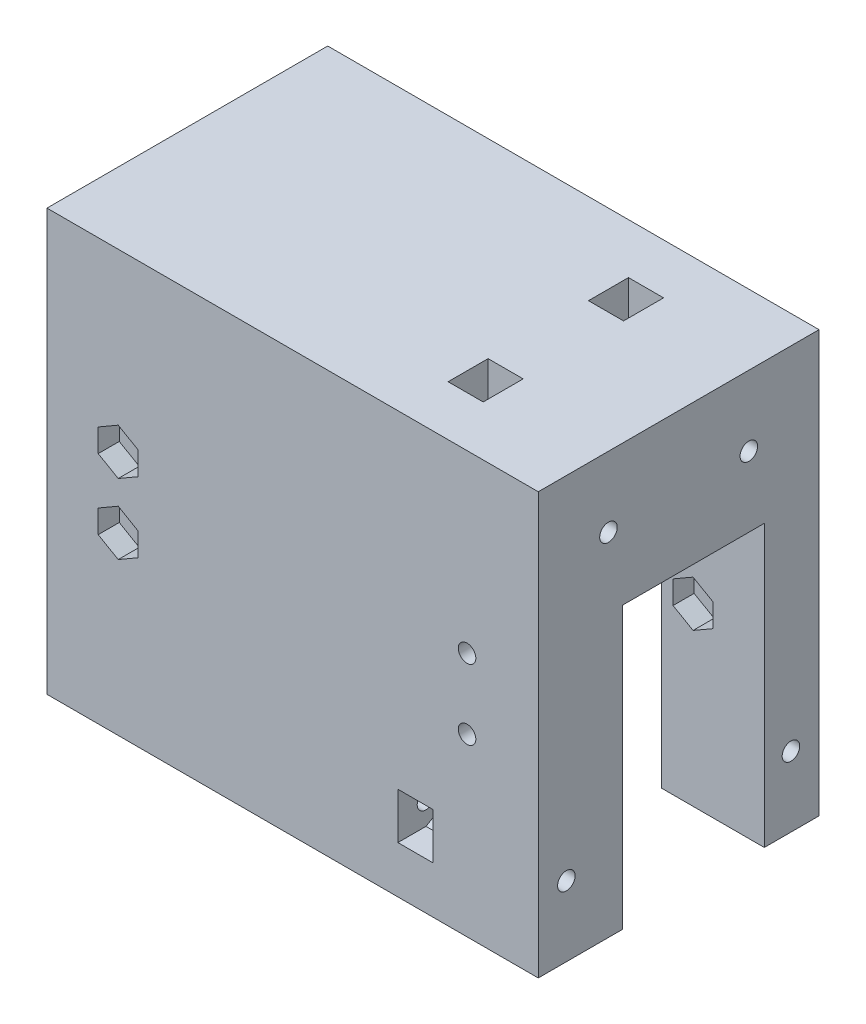
from build123d import *

# Parameters (mm, degrees)
SKETCH_2_W           = 70
SKETCH_2_H           = 60
EXTRUDE_2_DEPTH      = 40
SKETCH_3_W           = 40.7
SKETCH_3_H           = 20.5
CUT_EXTRUDE_1_DEPTH  = 28
SKETCH_4_W           = 14.65
SKETCH_4_H           = 20.5
EXTRUDE_3_DEPTH      = 28
SKETCH_15_W          = 40.7
SKETCH_15_H          = 40.25
CUT_EXTRUDE_6_DEPTH  = 28
SKETCH_16_W          = 14.65
SKETCH_16_H          = 20.204149113
CUT_EXTRUDE_7_DEPTH  = 40
M3X0_5_2_D           = 2.5
CUT_EXTRUDE_8_DEPTH  = 3
CUT_EXTRUDE_9_DEPTH  = 3
CUT_EXTRUDE_10_DEPTH = 6
M3X0_5_3_D           = 2.5
M3X0_5_3_DEPTH       = 40
M3X0_5_3_TIP         = 0.751075774
CUT_EXTRUDE_12_DEPTH = 5


with BuildPart() as part:
    # ｽｹｯﾁ2 → ﾎﾞｽ - 押し出し2 (new body)
    with BuildSketch(Plane.XY):
        Rectangle(SKETCH_2_W, SKETCH_2_H)
    extrude(amount=EXTRUDE_2_DEPTH)

    # ｽｹｯﾁ3 → ｶｯﾄ - 押し出し1 (cut)
    with BuildSketch(Plane.XY):
        Rectangle(SKETCH_3_W, SKETCH_3_H)
    extrude(amount=CUT_EXTRUDE_1_DEPTH, mode=Mode.SUBTRACT)

    # ｽｹｯﾁ4 → ﾎﾞｽ - 押し出し3 (add)
    with BuildSketch(Plane.XY):
        with Locations((27.675, 0)):
            Rectangle(SKETCH_4_W, SKETCH_4_H)
    extrude(amount=EXTRUDE_3_DEPTH)

    # ｽｹｯﾁ15 → ｶｯﾄ - 押し出し6 (cut)
    with BuildSketch(Plane.XY):
        with Locations((0, -9.875)):
            Rectangle(SKETCH_15_W, SKETCH_15_H)
    extrude(amount=CUT_EXTRUDE_6_DEPTH, mode=Mode.SUBTRACT)

    # ｽｹｯﾁ16 → ｶｯﾄ - 押し出し7 (cut)
    with BuildSketch(Plane(origin=(0, -30, 0), x_dir=(-1, 0, 0), z_dir=(0, -1, 0))):
        with Locations((-27.675, -17.897925444)):
            Rectangle(SKETCH_16_W, SKETCH_16_H)
    extrude(amount=-CUT_EXTRUDE_7_DEPTH, mode=Mode.SUBTRACT)

    # M3x0.5 ねじ穴2 (through all)
    with Locations(Plane(origin=(0, 0, 0), x_dir=(-1, 0, 0), z_dir=(0, 0, -1))):
        with Locations((24.85, 5), (24.85, -5)):
            m3x0_5_2 = Hole(M3X0_5_2_D / 2)

    # ﾐﾗｰ1: M3x0.5 ねじ穴2 across plane
    add(m3x0_5_2.mirror(Plane(origin=(0, 0, 0), x_dir=(0, 0, 1), z_dir=(1, 0, 0))), mode=Mode.SUBTRACT)

    # ｽｹｯﾁ17 → ｶｯﾄ - 押し出し8 (cut)
    with BuildSketch(Plane.XY.offset(40)):
        Polygon((-24.85, 8.290896534), (-27.7, 6.645448267), (-27.7, 3.354551733), (-24.85, 1.709103466), (-22, 3.354551733), (-22, 6.645448267), align=None)
        Polygon((-22, -6.645448267), (-22, -3.354551733), (-24.85, -1.709103466), (-27.7, -3.354551733), (-27.7, -6.645448267), (-24.85, -8.290896534), align=None)
    extrude(amount=-CUT_EXTRUDE_8_DEPTH, mode=Mode.SUBTRACT)

    # ｽｹｯﾁ18 → ｶｯﾄ - 押し出し9 (cut)
    with BuildSketch(Plane.XY.offset(7.795850887)):
        Polygon((27.7, 3.354551733), (27.7, 6.645448267), (24.85, 8.290896534), (22, 6.645448267), (22, 3.354551733), (24.85, 1.709103466), align=None)
        Polygon((27.7, -6.645448267), (27.7, -3.354551733), (24.85, -1.709103466), (22, -3.354551733), (22, -6.645448267), (24.85, -8.290896534), align=None)
    extrude(amount=-CUT_EXTRUDE_9_DEPTH, mode=Mode.SUBTRACT)

    # ｽｹｯﾁ19 → ｶｯﾄ - 押し出し10 (cut)
    with BuildSketch(Plane(origin=(0, 0, 20), x_dir=(-1, 0, 0), z_dir=(0, 0, -1))):
        Polygon((35, 1.709103466), (35, 8.290896534), (24.85, 8.290896534), (27.7, 6.645448267), (27.7, 3.354551733), (24.85, 1.709103466), align=None)
        Polygon((22, 6.645448267), (22, 3.354551733), (24.85, 1.709103466), (27.7, 3.354551733), (27.7, 6.645448267), (24.85, 8.290896534), align=None)
        Polygon((22, -6.645448267), (24.85, -8.290896534), (27.7, -6.645448267), (27.7, -3.354551733), (24.85, -1.709103466), (22, -3.354551733), align=None)
        Polygon((35, -8.290896534), (24.85, -8.290896534), (27.7, -6.645448267), (27.7, -3.354551733), (24.85, -1.709103466), (35, -1.709103466), align=None)
    extrude(amount=-CUT_EXTRUDE_10_DEPTH, mode=Mode.SUBTRACT)

    # M3x0.5 ねじ穴3
    with Locations(Plane(origin=(35, 0, 0), x_dir=(0, 0, -1), z_dir=(1, 0, 0))):
        with Locations((-4, -20), (-36, -20), (-10, 20), (-30, 20)):
            Hole(M3X0_5_3_D / 2, depth=M3X0_5_3_DEPTH)
            with Locations((0, 0, -(M3X0_5_3_DEPTH + M3X0_5_3_TIP / 2))):  # 118° drill point
                Cone(0, M3X0_5_3_D / 2, M3X0_5_3_TIP, mode=Mode.SUBTRACT)

    # ｽｹｯﾁ24 → ｶｯﾄ - 押し出し12 (cut)
    with BuildSketch(Plane(origin=(20, 0, 0), x_dir=(0, 0, -1), z_dir=(1, 0, 0))):
        Polygon((-38.85, -18.354551733), (-38.85, -21.645448267), (-36, -23.290896534), (-33.15, -21.645448267), (-33.15, -18.354551733), (-36, -16.709103466), align=None)
        Polygon((-40, -16.709103466), (-40, -23.290896534), (-36, -23.290896534), (-38.85, -21.645448267), (-38.85, -18.354551733), (-36, -16.709103466), align=None)
        Polygon((-6.85, -18.354551733), (-6.85, -21.645448267), (-4, -23.290896534), (-1.15, -21.645448267), (-1.15, -18.354551733), (-4, -16.709103466), align=None)
        Polygon((-10, 23.290896534), (-7.15, 21.645448267), (-7.15, 30), (-12.85, 30), (-12.85, 21.645448267), align=None)
        Polygon((-12.85, 21.645448267), (-12.85, 18.354551733), (-10, 16.709103466), (-7.15, 18.354551733), (-7.15, 21.645448267), (-10, 23.290896534), align=None)
        Polygon((-32.85, 21.645448267), (-32.85, 18.354551733), (-30, 16.709103466), (-27.15, 18.354551733), (-27.15, 21.645448267), (-30, 23.290896534), align=None)
        Polygon((-30, 23.290896534), (-27.15, 21.645448267), (-27.15, 30), (-32.85, 30), (-32.85, 21.645448267), align=None)
        Polygon((0, -23.290896534), (0, -16.709103466), (-4, -16.709103466), (-1.15, -18.354551733), (-1.15, -21.645448267), (-4, -23.290896534), align=None)
    extrude(amount=-CUT_EXTRUDE_12_DEPTH, mode=Mode.SUBTRACT)


solid = part.part
